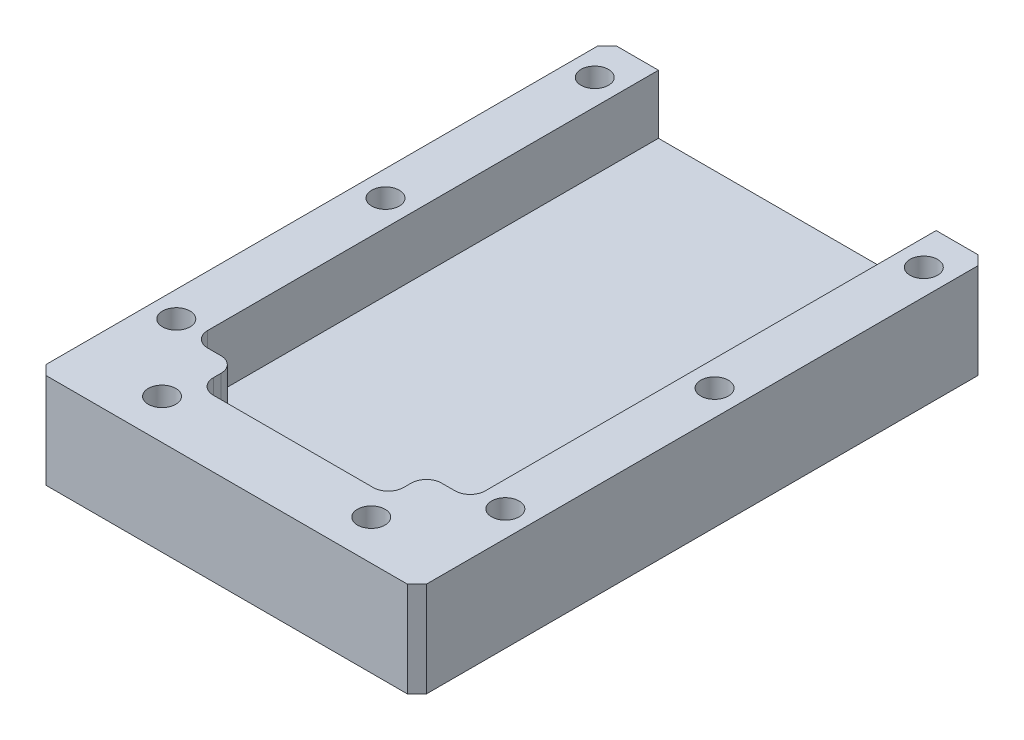
from build123d import *

# Parameters (mm, degrees)
SKETCH1_W              = 40
SKETCH1_H              = 60
BOSS_EXTRUDE1_DEPTH    = 10
M2_5_CLEARANCE_HOLE1_D = 2.9
CUT_EXTRUDE1_DEPTH     = 6.2
FILLET1_R              = 1.6
CHAMFER1_SIZE          = 1


with BuildPart() as part:
    # Sketch1 → Boss-Extrude1 (new body)
    with BuildSketch(Plane(origin=(0, 0, 0), x_dir=(1, 0, 0), z_dir=(0, 1, 0))):
        with Locations((-20, 0)):
            Rectangle(SKETCH1_W, SKETCH1_H)
    extrude(amount=BOSS_EXTRUDE1_DEPTH)

    # M2.5 Clearance Hole1 (through all)
    with Locations(Plane(origin=(0, 10, 0), x_dir=(1, 0, 0), z_dir=(0, 1, 0))):
        with Locations((-37.3, 26), (-37.3, 4), (-37.3, -18), (-31, -25.8), (-9, -25.8), (-2.7, -18), (-2.7, 4), (-2.7, 26)):
            Hole(M2_5_CLEARANCE_HOLE1_D / 2)

    # Sketch4 → Cut-Extrude1 (cut)
    with BuildSketch(Plane(origin=(0, 10, 0), x_dir=(1, 0, 0), z_dir=(0, 1, 0))):
        Polygon((-34.6, 30), (-34.6, -19), (-30, -19), (-30, -23), (-10, -23), (-10, -19), (-5.4, -19), (-5.4, 30), align=None)
    extrude(amount=-CUT_EXTRUDE1_DEPTH, mode=Mode.SUBTRACT)

    # Fillet1
    fillet1_edges = [part.edges().sort_by_distance(p)[0] for p in [
        (-10, 6.9, 23),
        (-30, 6.9, 23),
        (-30, 6.9, 19),
        (-34.6, 6.9, 19),
        (-5.4, 6.9, 19),
        (-10, 6.9, 19),
    ]]
    fillet(fillet1_edges, radius=FILLET1_R)

    # Chamfer1
    chamfer1_edges = [part.edges().sort_by_distance(p)[0] for p in [
        (-40, 5, -30),
        (0, 5, -30),
        (0, 5, 30),
        (-40, 5, 30),
    ]]
    chamfer(chamfer1_edges, length=CHAMFER1_SIZE)


solid = part.part
